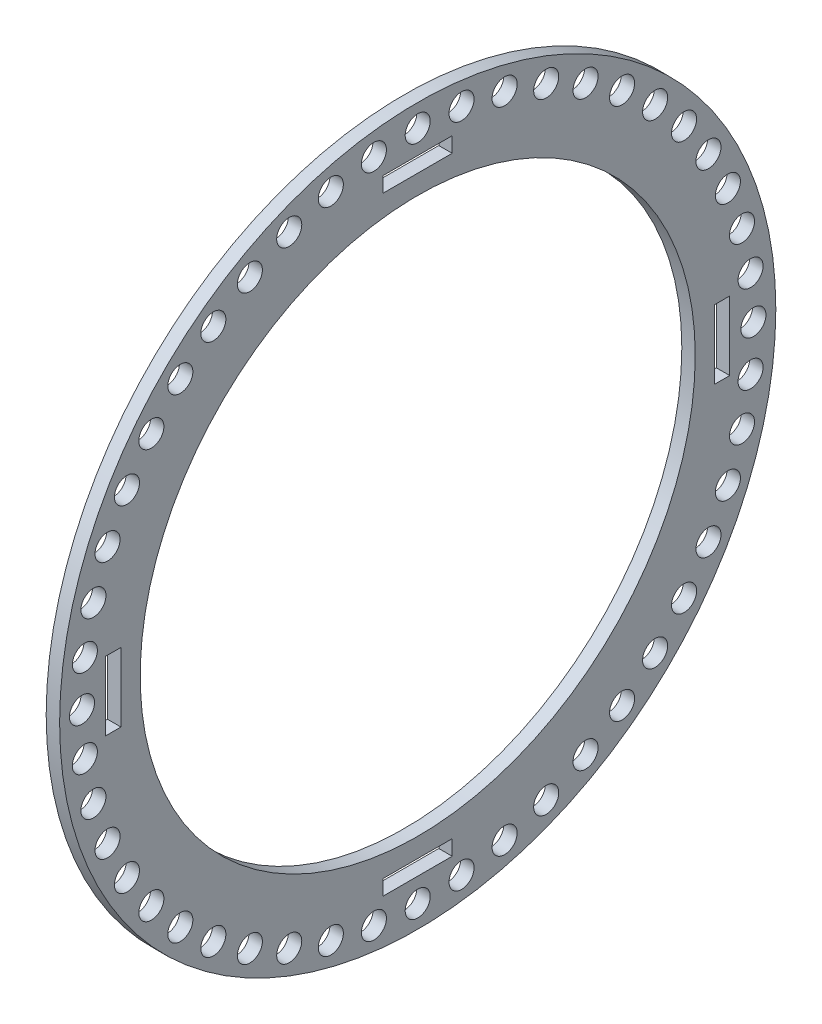
from build123d import *

# Parameters (mm, degrees)
SKETCH1_R           = 40
SKETCH1_R_2         = 31
SKETCH1_W           = 7.7
SKETCH1_H           = 1.7
SKETCH1_W_2         = 1.7
SKETCH1_H_2         = 7.7
BOSS_EXTRUDE4_DEPTH = 1.5
SKETCH2_R           = 1.4
CUT_EXTRUDE2_DEPTH  = 1.5
CIRPATTERN3_COUNT   = 48


with BuildPart() as part:
    # Sketch1 → Boss-Extrude4 (new body)
    with BuildSketch(Plane(origin=(0, 0, 0), x_dir=(0, 0, -1), z_dir=(1, 0, 0))):
        Circle(SKETCH1_R)
        Circle(SKETCH1_R_2, mode=Mode.SUBTRACT)
        with Locations((0, 34)):
            Rectangle(SKETCH1_W, SKETCH1_H, mode=Mode.SUBTRACT)
        with Locations((34, 0)):
            Rectangle(SKETCH1_W_2, SKETCH1_H_2, mode=Mode.SUBTRACT)
        with Locations((0, -34)):
            Rectangle(SKETCH1_W, SKETCH1_H, mode=Mode.SUBTRACT)
        with Locations((-34, 0)):
            Rectangle(SKETCH1_W_2, SKETCH1_H_2, mode=Mode.SUBTRACT)
    extrude(amount=BOSS_EXTRUDE4_DEPTH)

    # Sketch2 → Cut-Extrude2 (cut)
    with BuildSketch(Plane(origin=(1.5, 0, 0), x_dir=(0, 0, -1), z_dir=(1, 0, 0))):
        with Locations((0, 37.5)):
            Circle(SKETCH2_R)
    cut_extrude2 = extrude(amount=-CUT_EXTRUDE2_DEPTH, mode=Mode.SUBTRACT)

    # CirPattern3: Cut-Extrude2 ×48 about axis
    cirpattern3_axis = Axis((0, 0, 0), (1, 0, 0))
    for i in range(1, CIRPATTERN3_COUNT):
        add(cut_extrude2.rotate(cirpattern3_axis, i * 360 / CIRPATTERN3_COUNT), mode=Mode.SUBTRACT)


solid = part.part
